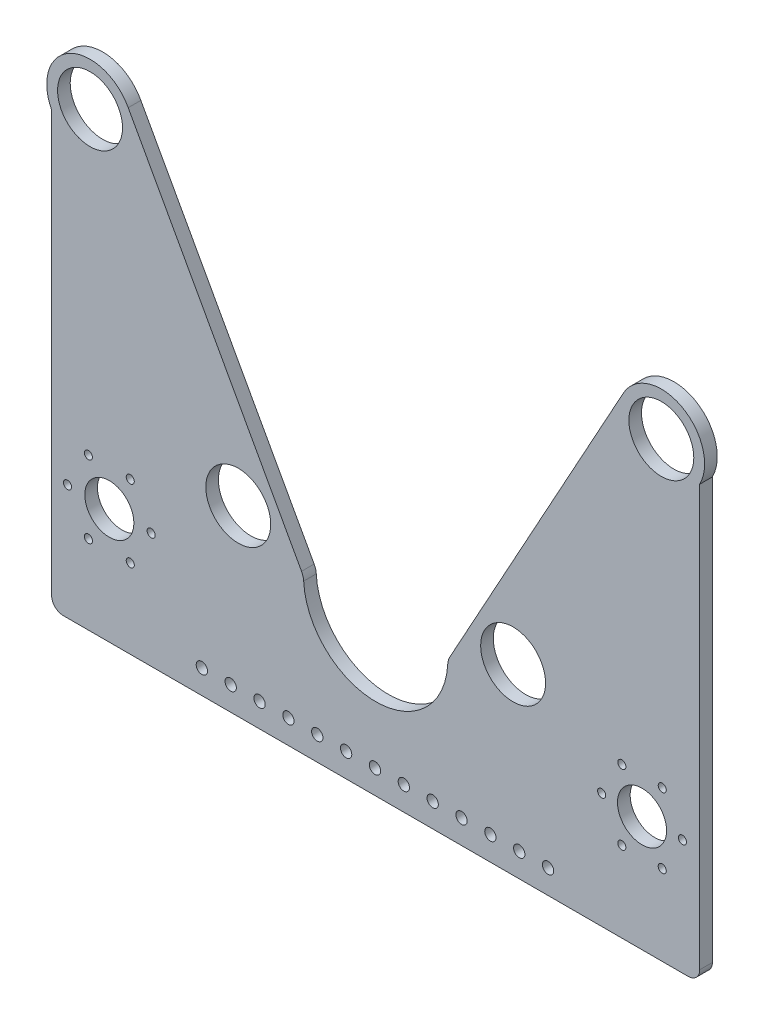
from build123d import *
from build123d.topology import SkipClean

# Parameters (mm, degrees)
SKETCH2_R           = 14.2875
SKETCH2_R_2         = 2.4892
SKETCH2_R_3         = 10.795
SKETCH2_R_4         = 1.778
BOSS_EXTRUDE1_DEPTH = 3.175
FILLET1_R           = 7.62
BOSS_EXTRUDE2_START = 2.38125
SKETCH4_R           = 14.2875
SKETCH4_R_2         = 1.778
SKETCH4_R_3         = 10.795
SKETCH4_R_4         = 2.4892
BOSS_EXTRUDE2_DEPTH = 2.38125


with BuildPart() as part:
    # Sketch2 → Boss-Extrude1 (new body)
    with BuildSketch(Plane.XY):
        with BuildLine():
            Line((142.632381685, 122.462939957), (142.632381685, -29.937060043))
            Line((142.632381685, -29.937060043), (142.632381685, -56.741928905))
            Line((142.632381685, -56.741928905), (142.632381685, -62.620500771))
            ThreePointArc((142.632381685, -62.620500771), (141.144484133, -66.21260322), (137.552381685, -67.700500771))
            Line((137.552381685, -67.700500771), (-137.552381685, -67.700500771))
            ThreePointArc((-137.552381685, -67.700500771), (-141.144484133, -66.21260322), (-142.632381685, -62.620500771))
            Line((-142.632381685, -62.620500771), (-142.632381685, -56.741928905))
            Line((-142.632381685, -56.741928905), (-142.632381685, -29.937060043))
            Line((-142.632381685, -29.937060043), (-142.632381685, 122.462939957))
            ThreePointArc((-142.632381685, 122.462939957), (-134.600001748, 148.101160684), (-108.918256202, 140.209048469))
            Line((-108.918256202, 140.209048469), (-31.75, 0))
            ThreePointArc((-31.75, 0), (0, -31.75), (31.75, 0))
            Line((31.75, 0), (108.918256202, 140.209048469))
            ThreePointArc((108.918256202, 140.209048469), (134.600001748, 148.101160684), (142.632381685, 122.462939957))
        make_face()
        with Locations((-60.484532313, 12.7)):
            Circle(SKETCH2_R, mode=Mode.SUBTRACT)
        with Locations((-125.726814921, 131.243846084)):
            Circle(SKETCH2_R, mode=Mode.SUBTRACT)
        with Locations((125.726814921, 131.243846084)):
            Circle(SKETCH2_R, mode=Mode.SUBTRACT)
        with Locations((60.484532313, 12.7)):
            Circle(SKETCH2_R, mode=Mode.SUBTRACT)
        with Locations((-76.5175, -57.15)):
            Circle(SKETCH2_R_2, mode=Mode.SUBTRACT)
        with Locations((-63.8175, -57.15)):
            Circle(SKETCH2_R_2, mode=Mode.SUBTRACT)
        with Locations((-51.1175, -57.15)):
            Circle(SKETCH2_R_2, mode=Mode.SUBTRACT)
        with Locations((-38.4175, -57.15)):
            Circle(SKETCH2_R_2, mode=Mode.SUBTRACT)
        with Locations((-25.7175, -57.15)):
            Circle(SKETCH2_R_2, mode=Mode.SUBTRACT)
        with Locations((-13.0175, -57.15)):
            Circle(SKETCH2_R_2, mode=Mode.SUBTRACT)
        with Locations((-0.3175, -57.15)):
            Circle(SKETCH2_R_2, mode=Mode.SUBTRACT)
        with Locations((12.3825, -57.15)):
            Circle(SKETCH2_R_2, mode=Mode.SUBTRACT)
        with Locations((25.0825, -57.15)):
            Circle(SKETCH2_R_2, mode=Mode.SUBTRACT)
        with Locations((37.7825, -57.15)):
            Circle(SKETCH2_R_2, mode=Mode.SUBTRACT)
        with Locations((50.4825, -57.15)):
            Circle(SKETCH2_R_2, mode=Mode.SUBTRACT)
        with Locations((63.1825, -57.15)):
            Circle(SKETCH2_R_2, mode=Mode.SUBTRACT)
        with Locations((75.8825, -57.15)):
            Circle(SKETCH2_R_2, mode=Mode.SUBTRACT)
        with Locations((-117.232381685, -16.900500771)):
            Circle(SKETCH2_R_3, mode=Mode.SUBTRACT)
        with Locations((117.232381685, -16.900500771)):
            Circle(SKETCH2_R_3, mode=Mode.SUBTRACT)
        with Locations((-135.647381685, -16.900500771)):
            Circle(SKETCH2_R_4, mode=Mode.SUBTRACT)
        with Locations((-126.439881685, -0.95264296)):
            Circle(SKETCH2_R_4, mode=Mode.SUBTRACT)
        with Locations((-108.024881685, -0.95264296)):
            Circle(SKETCH2_R_4, mode=Mode.SUBTRACT)
        with Locations((-98.817381685, -16.900500771)):
            Circle(SKETCH2_R_4, mode=Mode.SUBTRACT)
        with Locations((-108.024881685, -32.848358582)):
            Circle(SKETCH2_R_4, mode=Mode.SUBTRACT)
        with Locations((-126.439881685, -32.848358582)):
            Circle(SKETCH2_R_4, mode=Mode.SUBTRACT)
        with Locations((99.452381685, -16.900500771)):
            Circle(SKETCH2_R_4, mode=Mode.SUBTRACT)
        with Locations((108.342381685, -1.502569092)):
            Circle(SKETCH2_R_4, mode=Mode.SUBTRACT)
        with Locations((126.122381685, -1.502569092)):
            Circle(SKETCH2_R_4, mode=Mode.SUBTRACT)
        with Locations((135.012381685, -16.900500771)):
            Circle(SKETCH2_R_4, mode=Mode.SUBTRACT)
        with Locations((126.122381685, -32.29843245)):
            Circle(SKETCH2_R_4, mode=Mode.SUBTRACT)
        with Locations((108.342381685, -32.29843245)):
            Circle(SKETCH2_R_4, mode=Mode.SUBTRACT)
    extrude(amount=BOSS_EXTRUDE1_DEPTH)

    # Fillet1
    fillet1_edges = [part.edges().sort_by_distance(p)[0] for p in [
        (-31.75, 0, 1.5875),
        (31.75, 0, 1.5875),
    ]]
    fillet(fillet1_edges, radius=FILLET1_R)

    # Sketch4 → Boss-Extrude2 (add)
    with SkipClean():  # the faces are left unmerged after this step: merging them gives an invalid solid
        with BuildSketch(Plane(origin=(0, 0, 0), x_dir=(-1, 0, 0), z_dir=(0, 0, -1)).offset(BOSS_EXTRUDE2_START)):
            with BuildLine():
                Line((-32.640582486, 1.618122906), (-108.918256202, 140.209048469))
                ThreePointArc((-108.918256202, 140.209048469), (-134.600001748, 148.101160684), (-142.632381685, 122.462939957))
                Line((-142.632381685, 122.462939957), (-142.632381685, -62.620500771))
                ThreePointArc((-142.632381685, -62.620500771), (-141.144484133, -66.21260322), (-137.552381685, -67.700500771))
                Line((-137.552381685, -67.700500771), (137.552381685, -67.700500771))
                ThreePointArc((137.552381685, -67.700500771), (141.144484133, -66.21260322), (142.632381685, -62.620500771))
                Line((142.632381685, -62.620500771), (142.632381685, 122.462939957))
                ThreePointArc((142.632381685, 122.462939957), (134.600001748, 148.101160684), (108.918256202, 140.209048469))
                Line((108.918256202, 140.209048469), (32.640582486, 1.618122906))
                ThreePointArc((32.640582486, 1.618122906), (31.988191315, 0.032870886), (31.706674385, -1.65810115))
                ThreePointArc((31.706674385, -1.65810115), (0, -31.75), (-31.706674385, -1.65810115))
                ThreePointArc((-31.706674385, -1.65810115), (-31.988191315, 0.032870886), (-32.640582486, 1.618122906))
            make_face()
            with Locations((125.726814921, 131.243846084)):
                Circle(SKETCH4_R, mode=Mode.SUBTRACT)
            with Locations((108.024881685, -32.848358582)):
                Circle(SKETCH4_R_2, mode=Mode.SUBTRACT)
            with Locations((126.439881685, -32.848358582)):
                Circle(SKETCH4_R_2, mode=Mode.SUBTRACT)
            with Locations((135.647381685, -16.900500771)):
                Circle(SKETCH4_R_2, mode=Mode.SUBTRACT)
            with Locations((126.439881685, -0.95264296)):
                Circle(SKETCH4_R_2, mode=Mode.SUBTRACT)
            with Locations((108.024881685, -0.95264296)):
                Circle(SKETCH4_R_2, mode=Mode.SUBTRACT)
            with Locations((98.817381685, -16.900500771)):
                Circle(SKETCH4_R_2, mode=Mode.SUBTRACT)
            with Locations((117.232381685, -16.900500771)):
                Circle(SKETCH4_R_3, mode=Mode.SUBTRACT)
            with Locations((60.484532313, 12.7)):
                Circle(SKETCH4_R, mode=Mode.SUBTRACT)
            with Locations((76.5175, -57.15)):
                Circle(SKETCH4_R_4, mode=Mode.SUBTRACT)
            with Locations((63.8175, -57.15)):
                Circle(SKETCH4_R_4, mode=Mode.SUBTRACT)
            with Locations((51.1175, -57.15)):
                Circle(SKETCH4_R_4, mode=Mode.SUBTRACT)
            with Locations((38.4175, -57.15)):
                Circle(SKETCH4_R_4, mode=Mode.SUBTRACT)
            with Locations((25.7175, -57.15)):
                Circle(SKETCH4_R_4, mode=Mode.SUBTRACT)
            with Locations((13.0175, -57.15)):
                Circle(SKETCH4_R_4, mode=Mode.SUBTRACT)
            with Locations((0.3175, -57.15)):
                Circle(SKETCH4_R_4, mode=Mode.SUBTRACT)
            with Locations((-12.3825, -57.15)):
                Circle(SKETCH4_R_4, mode=Mode.SUBTRACT)
            with Locations((-25.0825, -57.15)):
                Circle(SKETCH4_R_4, mode=Mode.SUBTRACT)
            with Locations((-37.7825, -57.15)):
                Circle(SKETCH4_R_4, mode=Mode.SUBTRACT)
            with Locations((-50.4825, -57.15)):
                Circle(SKETCH4_R_4, mode=Mode.SUBTRACT)
            with Locations((-63.1825, -57.15)):
                Circle(SKETCH4_R_4, mode=Mode.SUBTRACT)
            with Locations((-75.8825, -57.15)):
                Circle(SKETCH4_R_4, mode=Mode.SUBTRACT)
            with Locations((-99.452381685, -16.900500771)):
                Circle(SKETCH4_R_2, mode=Mode.SUBTRACT)
            with Locations((-108.342381685, -32.29843245)):
                Circle(SKETCH4_R_2, mode=Mode.SUBTRACT)
            with Locations((-126.122381685, -32.29843245)):
                Circle(SKETCH4_R_2, mode=Mode.SUBTRACT)
            with Locations((-135.012381685, -16.900500771)):
                Circle(SKETCH4_R_2, mode=Mode.SUBTRACT)
            with Locations((-126.122381685, -1.502569092)):
                Circle(SKETCH4_R_2, mode=Mode.SUBTRACT)
            with Locations((-108.342381685, -1.502569092)):
                Circle(SKETCH4_R_2, mode=Mode.SUBTRACT)
            with Locations((-117.232381685, -16.900500771)):
                Circle(SKETCH4_R_3, mode=Mode.SUBTRACT)
            with Locations((-60.484532313, 12.7)):
                Circle(SKETCH4_R, mode=Mode.SUBTRACT)
            with Locations((-125.726814921, 131.243846084)):
                Circle(SKETCH4_R, mode=Mode.SUBTRACT)
        extrude(amount=-BOSS_EXTRUDE2_DEPTH)


solid = part.part
